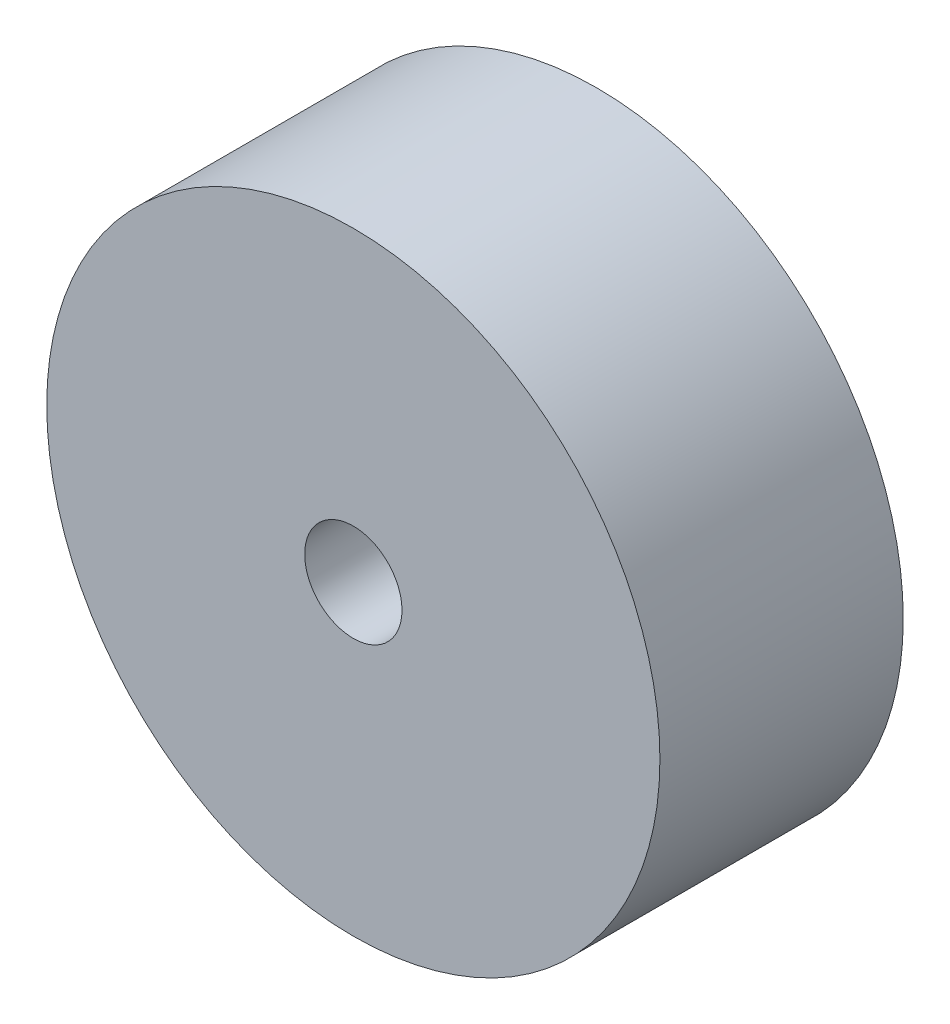
from build123d import *

# Parameters (mm, degrees)
SKETCH_1_R      = 31.5
SKETCH_1_R_2    = 5
EXTRUDE_1_DEPTH = 25


with BuildPart() as part:
    # Эскиз1 → Вытянуть1 (new body)
    with BuildSketch(Plane.XY):
        Circle(SKETCH_1_R)
        Circle(SKETCH_1_R_2, mode=Mode.SUBTRACT)
    extrude(amount=EXTRUDE_1_DEPTH)


solid = part.part
